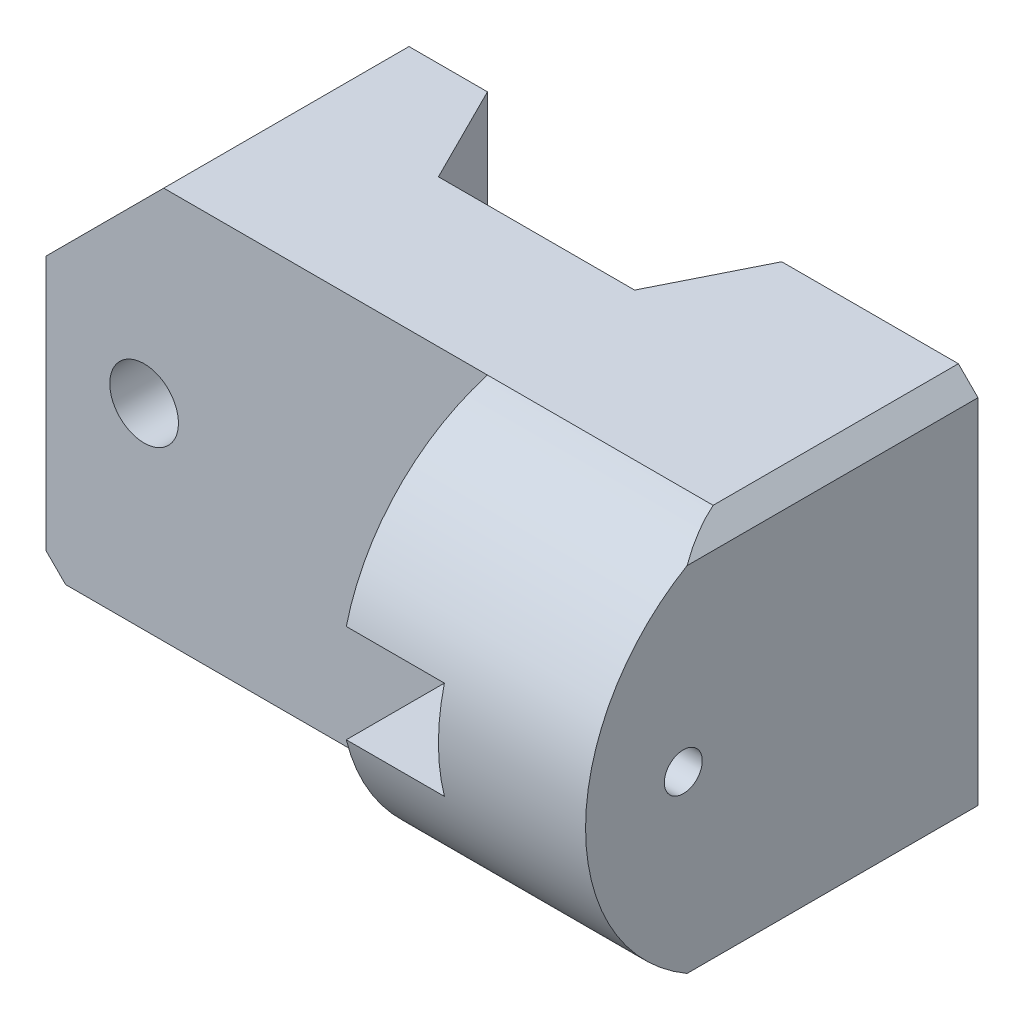
from build123d import *

# Parameters (mm, degrees)
SKETCH1_R           = 3.5
BOSS_EXTRUDE1_DEPTH = 12.5
CUT_EXTRUDE1_DEPTH  = 55.60082417
BOSS_EXTRUDE3_DEPTH = 25
CUT_EXTRUDE2_DEPTH  = 57.789083458
SKETCH8_W           = 10
SKETCH8_H           = 10
CUT_EXTRUDE3_DEPTH  = 48.434164903
SKETCH9_R           = 1.934793031
CUT_EXTRUDE4_DEPTH  = 65.662585782


with BuildPart() as part:
    # Sketch1 → Boss-Extrude1 (new, symmetric)
    with BuildSketch(Plane.XY):
        Polygon((-23, 20), (-35, 8), (-35, -18), (-33, -20), (33, -20), (35, -18), (35, 18), (33, 20), align=None)
        with Locations((-25, 0)):
            Circle(SKETCH1_R, mode=Mode.SUBTRACT)
    extrude(amount=BOSS_EXTRUDE1_DEPTH, both=True)

    # Sketch2 → Cut-Extrude1 (cut, through all)
    with BuildSketch(Plane.XZ.offset(20)):
        Polygon((-10, -2.5), (10, -2.5), (15, -12.5), (-15, -12.5), align=None)
    extrude(amount=-CUT_EXTRUDE1_DEPTH, mode=Mode.SUBTRACT)

    # Sketch5 → Boss-Extrude3 (add)
    with BuildSketch(Plane(origin=(35, 0, 0), x_dir=(0, 0, -1), z_dir=(1, 0, 0))):
        with BuildLine():
            Line((-12.5, 20), (-12.5, -20))
            ThreePointArc((-12.5, -20), (-27.5, 0), (-12.5, 20))
        make_face()
    extrude(amount=-BOSS_EXTRUDE3_DEPTH)

    # Sketch6 → Cut-Extrude2 (cut, through all)
    with BuildSketch(Plane(origin=(0, 0, -12.5), x_dir=(-1, 0, 0), z_dir=(0, 0, -1))):
        Polygon((-35, 20), (-35, 18), (-33, 20), align=None)
        Polygon((-35, -20), (-33, -20), (-35, -18), align=None)
    extrude(amount=-CUT_EXTRUDE2_DEPTH, mode=Mode.SUBTRACT)

    # Sketch8 → Cut-Extrude3 (cut, through all)
    with BuildSketch(Plane.XY.offset(12.5)):
        with Locations((15, 0)):
            Rectangle(SKETCH8_W, SKETCH8_H)
    extrude(amount=CUT_EXTRUDE3_DEPTH, mode=Mode.SUBTRACT)

    # Sketch9 → Cut-Extrude4 (cut, through all)
    with BuildSketch(Plane.ZY.offset(-20)):
        with Locations((17.540032759, 0)):
            Circle(SKETCH9_R)
    extrude(amount=-CUT_EXTRUDE4_DEPTH, mode=Mode.SUBTRACT)


solid = part.part
